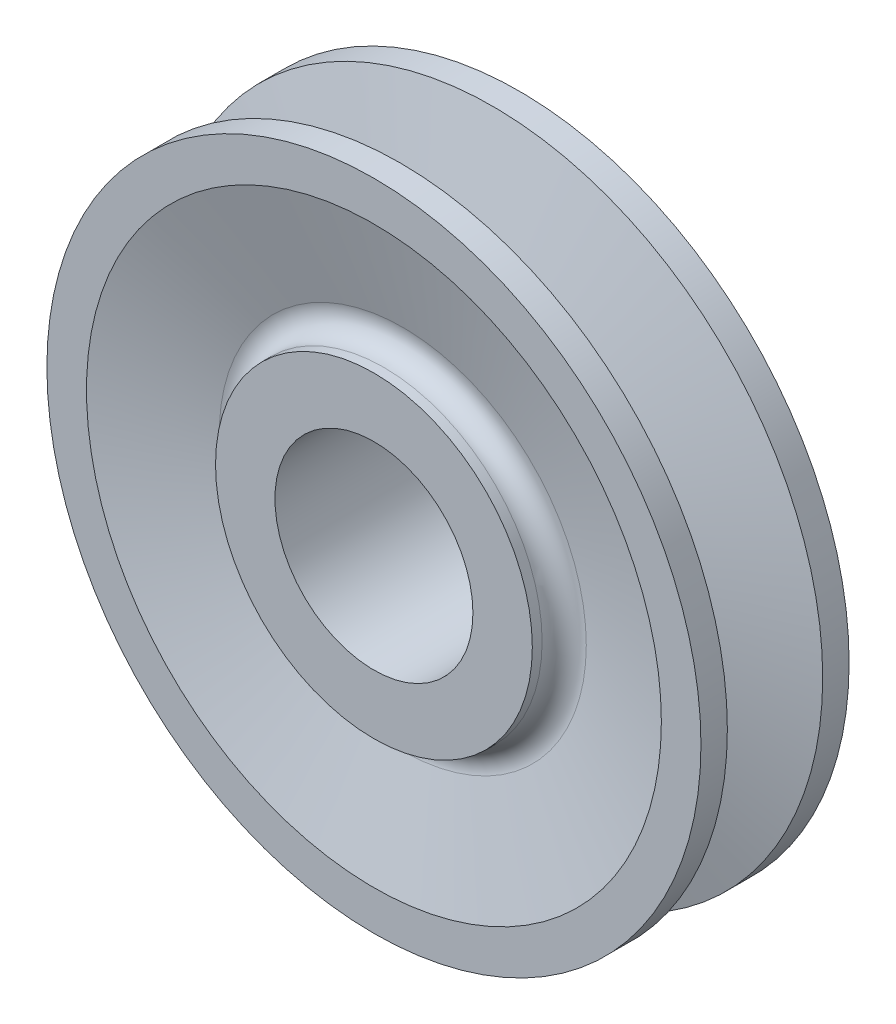
from build123d import *


with BuildPart() as part:
    # Sketch2 → Revolve2 (revolve)
    with BuildSketch(Plane(origin=(0, 0, 0), x_dir=(0, 0, -1), z_dir=(1, 0, 0)), mode=Mode.PRIVATE) as revolve2_sk:
        with BuildLine():
            Line((0, 0), (31, 0))
            Line((31, 0), (31, 9))
            Line((31, 9), (24.583151623, 9))
            ThreePointArc((24.583151623, 9), (19.839895343, 11.325558565), (18.773545819, 16.499493381))
            Line((18.773545819, 16.499493381), (22, 29))
            Line((22, 29), (22, 35))
            Line((22, 35), (18, 35))
            Line((18, 35), (13.354094276, 17))
            Line((13.354094276, 17), (8.876757203, 17))
            Line((8.876757203, 17), (4, 34.552318614))
            Line((4, 34.552318614), (0, 34.552318614))
            Line((0, 34.552318614), (0, 28.552318614))
            Line((0, 28.552318614), (4.37578125, 12.803101771))
            ThreePointArc((4.37578125, 12.803101771), (3.873716269, 10.184690841), (1.485274798, 9))
            Line((1.485274798, 9), (0, 9))
            Line((0, 9), (0, 0))
        make_face()
    revolve(revolve2_sk.sketch.rotate(Axis((0, -15, 0), (0, 0, -1)), 90), axis=Axis((0, -15, 0), (0, 0, -1)))


solid = part.part
